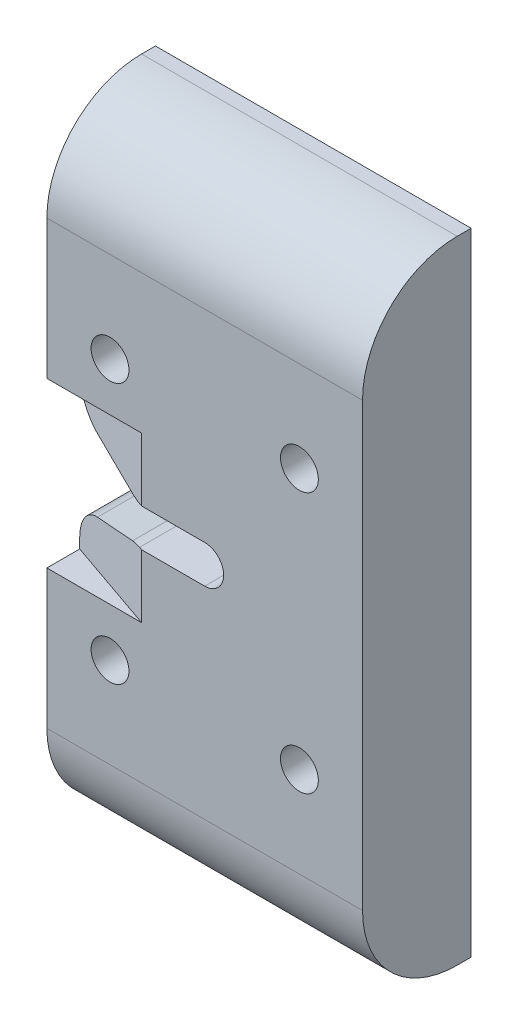
from build123d import *

# Parameters (mm, degrees)
SKETCH_1_W          = 50
SKETCH_1_H          = 100
EXTRUDE_1_DEPTH     = 17.2
FILLET_1_R          = 15
CUT_EXTRUDE_3_DEPTH = 26
SKETCH_6_R          = 3
CUT_EXTRUDE_4_DEPTH = 114.11869872
CUT_EXTRUDE_5_DEPTH = 114.11869872
FILLET_2_R          = 6
FILLET_3_R          = 6
SKETCH_9_R          = 3
CUT_EXTRUDE_6_DEPTH = 114.11869872
SKETCH_10_R         = 6
CUT_EXTRUDE_7_DEPTH = 9


with BuildPart() as part:
    # Эскиз1 → Бобышка-Вытянуть1 (new body)
    with BuildSketch(Plane.XY):
        with Locations((25, 50)):
            Rectangle(SKETCH_1_W, SKETCH_1_H)
    extrude(amount=EXTRUDE_1_DEPTH)

    # Скругление1
    fillet_1_edges = [part.edges().sort_by_distance(p)[0] for p in [
        (25, 100, 17.2),
        (25, 0, 17.2),
    ]]
    fillet(fillet_1_edges, radius=FILLET_1_R)

    # Эскиз5 → Вырез-Вытянуть3 (cut)
    with BuildSketch(Plane(origin=(0, 37, 0), x_dir=(1, 0, 0), z_dir=(0, 1, 0))):
        Polygon((0, -17.2), (0, -12), (15, -17.2), align=None)
    extrude(amount=CUT_EXTRUDE_3_DEPTH, mode=Mode.SUBTRACT)

    # Эскиз6 → Вырез-Вытянуть4 (cut, through all)
    with BuildSketch(Plane.XY.offset(17.2)):
        with Locations((25, 50)):
            Circle(SKETCH_6_R)
    extrude(amount=-CUT_EXTRUDE_4_DEPTH, mode=Mode.SUBTRACT)

    # Эскиз7 → Вырез-Вытянуть5 (cut, through all)
    with BuildSketch(Plane(origin=(0, 0, 0), x_dir=(-1, 0, 0), z_dir=(0, 0, -1))):
        Polygon((0, 57), (0, 43), (-13.646386899, 47), (-25, 47), (-25, 53), (-13.646386899, 53), align=None)
    extrude(amount=-CUT_EXTRUDE_5_DEPTH, mode=Mode.SUBTRACT)

    # Скругление2
    fillet_2_edges = [part.edges().sort_by_distance(p)[0] for p in [
        (0, 57, 6),
        (0, 43, 6),
    ]]
    fillet(fillet_2_edges, radius=FILLET_2_R)

    # Скругление3
    fillet_3_edges = [part.edges().sort_by_distance(p)[0] for p in [
        (13.646386899, 53, 8.365373729),
        (13.646386899, 47, 8.365373729),
    ]]
    fillet(fillet_3_edges, radius=FILLET_3_R)

    # Эскиз9 → Вырез-Вытянуть6 (cut, through all)
    with BuildSketch(Plane(origin=(0, 0, 0), x_dir=(-1, 0, 0), z_dir=(0, 0, -1))):
        with Locations((-40, 29.35)):
            Circle(SKETCH_9_R)
        with Locations((-10, 29.35)):
            Circle(SKETCH_9_R)
        with Locations((-10, 70.65)):
            Circle(SKETCH_9_R)
        with Locations((-40, 70.65)):
            Circle(SKETCH_9_R)
    extrude(amount=-CUT_EXTRUDE_6_DEPTH, mode=Mode.SUBTRACT)

    # Эскиз10 → Вырез-Вытянуть7 (cut)
    with BuildSketch(Plane(origin=(0, 0, 0), x_dir=(-1, 0, 0), z_dir=(0, 0, -1))):
        with Locations((-40, 29.35)):
            Circle(SKETCH_10_R)
        with Locations((-10, 29.35)):
            Circle(SKETCH_10_R)
        with Locations((-10, 70.65)):
            Circle(SKETCH_10_R)
        with Locations((-40, 70.65)):
            Circle(SKETCH_10_R)
    extrude(amount=-CUT_EXTRUDE_7_DEPTH, mode=Mode.SUBTRACT)


solid = part.part
